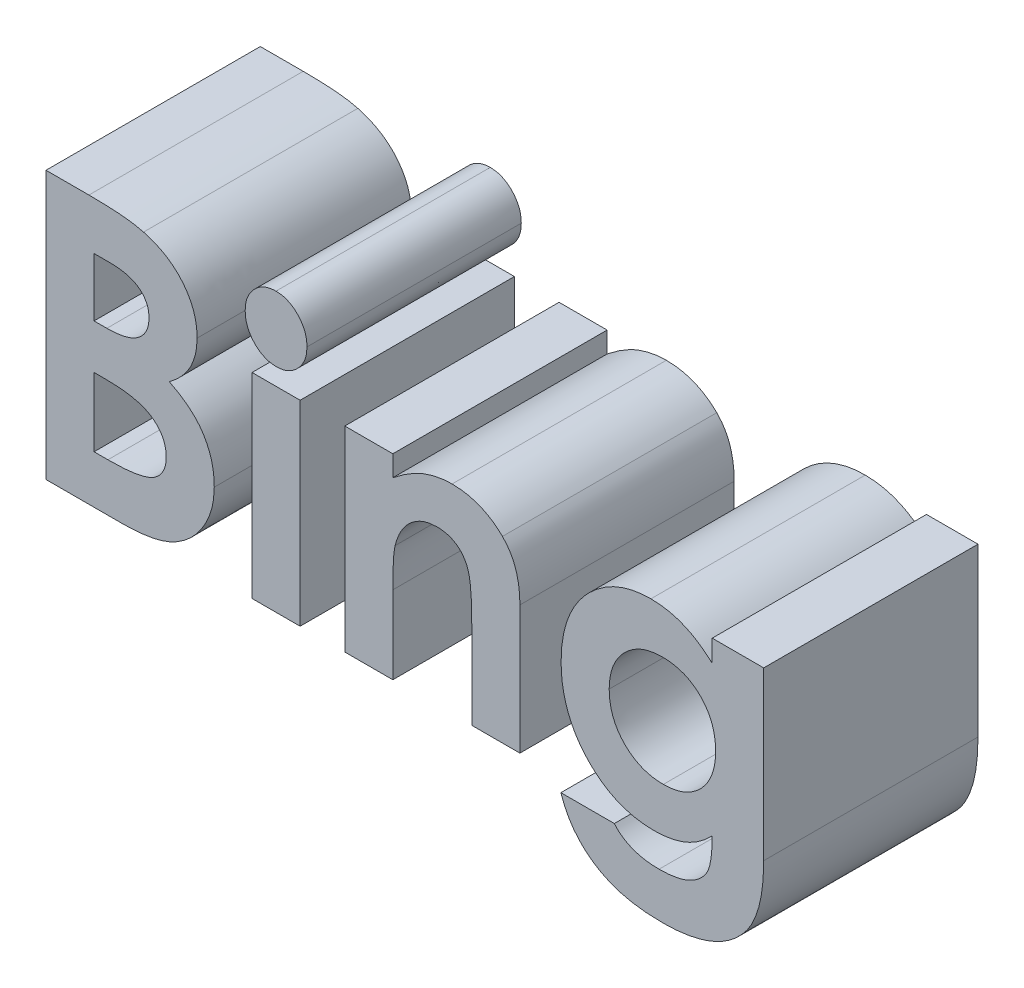
from build123d import *

# Parameters (mm, degrees)
BOSS_EXTRUDE1_DEPTH   = 2.54
BOSS_EXTRUDE1_2_DEPTH = 2.54
SKETCH1_W             = 0.569871795
SKETCH1_H             = 2.320192308
BOSS_EXTRUDE1_3_DEPTH = 2.54
BOSS_EXTRUDE1_4_DEPTH = 2.54
BOSS_EXTRUDE1_5_DEPTH = 2.54


with BuildPart() as part:
    # Sketch1 → Boss-Extrude1 (new body)
    with BuildSketch(Plane.XY):
        with BuildLine():
            Line((0.366346154, 0), (0.366346154, 3.175))
            Line((0.366346154, 3.175), (0.875160256, 3.175))
            add(Edge.make_bspline(
                [(0.875160256, 3.175), (0.910780425, 3.175004065), (0.979704776, 3.175011931), (1.079144627, 3.17151993), (1.171366691, 3.167002635), (1.256077481, 3.161948833), (1.333421182, 3.153240122), (1.403280178, 3.144062092), (1.46579405, 3.132993954), (1.504442981, 3.12306549), (1.522626202, 3.118394431)],
                knots=[0, 0, 0, 0, 1.311965854, 2.538629056, 3.664479157, 4.713267157, 5.663616078, 6.530575999, 7.308677837, 8, 8, 8, 8], degree=3))
            add(Edge.make_bspline(
                [(1.522626202, 3.118394431), (1.546502618, 3.111805819), (1.593355811, 3.098876846), (1.660464535, 3.072766227), (1.724126521, 3.043742423), (1.784264039, 3.010631691), (1.840507821, 2.973034291), (1.892644122, 2.93065184), (1.941797392, 2.885185567), (1.986222312, 2.83536834), (2.026375119, 2.782727211), (2.06126071, 2.727275975), (2.091571817, 2.669862516), (2.115828642, 2.609764324), (2.134105704, 2.547258168), (2.14747347, 2.482610959), (2.156137594, 2.415618137), (2.15695624, 2.37004073), (2.157371795, 2.346905048)],
                knots=[0, 0, 0, 0, 1.099996261, 2.158545794, 3.195537121, 4.207578794, 5.205712374, 6.197378256, 7.190519799, 8.17788031, 9.159561366, 10.129234751, 11.085776129, 12.040971148, 13.00380137, 13.975669004, 14.972423361, 16, 16, 16, 16], degree=3))
            add(Edge.make_bspline(
                [(2.157371795, 2.346905048), (2.156285241, 2.317181769), (2.154146494, 2.258675147), (2.14048403, 2.172739505), (2.11486478, 2.091517971), (2.081342616, 2.013513663), (2.035762953, 1.939017538), (1.977885596, 1.868065017), (1.908647969, 1.798471365), (1.855538887, 1.756754665), (1.827914663, 1.73505609)],
                knots=[0, 0, 0, 0, 0.986156485, 1.941127874, 2.875419072, 3.804401753, 4.751181392, 5.761612777, 6.835722519, 8, 8, 8, 8], degree=3))
            add(Edge.make_bspline(
                [(1.827914663, 1.73505609), (1.850300009, 1.723628565), (1.894191478, 1.701222351), (1.956504469, 1.664393223), (2.014199497, 1.625220775), (2.067535248, 1.584493172), (2.115392945, 1.540483912), (2.159748712, 1.495728868), (2.198414265, 1.447663764), (2.232990168, 1.39800173), (2.263042981, 1.346023655), (2.289215667, 1.291817318), (2.311322796, 1.235197538), (2.330043685, 1.176452465), (2.344005729, 1.115380042), (2.353109278, 1.051958428), (2.360079525, 0.986403923), (2.360621744, 0.94174983), (2.360897436, 0.919045473)],
                knots=[0, 0, 0, 0, 1.164658916, 2.283573913, 3.35186032, 4.395461096, 5.390182219, 6.362969632, 7.312859996, 8.245001507, 9.165155236, 10.092416118, 11.032087915, 11.979892451, 12.947605196, 13.931445124, 14.948243989, 16, 16, 16, 16], degree=3))
            add(Edge.make_bspline(
                [(2.360897436, 0.919045473), (2.359108383, 0.875681448), (2.355577694, 0.790102718), (2.32976302, 0.664453489), (2.285008578, 0.545326623), (2.224912592, 0.433195582), (2.150862773, 0.331306375), (2.065726717, 0.242052315), (1.970361548, 0.166500734), (1.882375654, 0.115509278), (1.806274784, 0.081289243), (1.743241855, 0.060132259), (1.675545826, 0.040532461), (1.601946667, 0.026769079), (1.523778631, 0.014171317), (1.440279575, 0.006393198), (1.351605558, 0.001122159), (1.290700409, 0.000381615), (1.259314904, 0)],
                knots=[0, 0, 0, 0, 1.284142165, 2.534249414, 3.780121997, 5.041676246, 6.291546858, 7.49970053, 8.684500223, 9.883330709, 10.50184324, 11.153274765, 11.851151195, 12.587658647, 13.369265475, 14.195992086, 15.070362669, 16, 16, 16, 16], degree=3))
            Line((1.259314904, 0), (0.366346154, 0))
        make_face()
        with BuildLine():
            Line((0.936217949, 2.605128205), (0.936217949, 1.913141026))
            Line((0.936217949, 1.913141026), (1.087590144, 1.913141026))
            add(Edge.make_bspline(
                [(1.087590144, 1.913141026), (1.108162986, 1.913320429), (1.147877611, 1.913666755), (1.205241174, 1.918127321), (1.258580025, 1.925737323), (1.307691859, 1.936355191), (1.353034171, 1.949838335), (1.394317303, 1.966061461), (1.431359738, 1.985855437), (1.474394481, 2.015339439), (1.519885308, 2.058726468), (1.559930371, 2.12140802), (1.583516645, 2.193491567), (1.58614352, 2.244330466), (1.5875, 2.270582933)],
                knots=[0, 0, 0, 0, 1.065314748, 2.056525647, 2.977365736, 3.853934255, 4.656397591, 5.425096493, 6.14721249, 6.826394842, 8.123232004, 9.372140726, 10.643011755, 12, 12, 12, 12], degree=3))
            add(Edge.make_bspline(
                [(1.5875, 2.270582933), (1.586414568, 2.29517273), (1.584315928, 2.342716114), (1.560567582, 2.409471259), (1.523681706, 2.46862998), (1.480132744, 2.509119286), (1.439122935, 2.536772289), (1.404007819, 2.554980614), (1.365466343, 2.57128052), (1.322752384, 2.583743825), (1.276109864, 2.593095851), (1.22576535, 2.599963794), (1.171631981, 2.604638408), (1.134241948, 2.604961437), (1.114938902, 2.605128205)],
                knots=[0, 0, 0, 0, 1.347982417, 2.606269829, 3.849316587, 5.153353503, 5.842674298, 6.568177932, 7.326619318, 8.142485038, 9.012069166, 9.942760135, 10.937925643, 12, 12, 12, 12], degree=3))
            Line((1.114938902, 2.605128205), (0.936217949, 2.605128205))
        make_face(mode=Mode.SUBTRACT)
        with BuildLine():
            Line((0.936217949, 1.383974359), (0.936217949, 0.569871795))
            Line((0.936217949, 0.569871795), (1.100310497, 0.569871795))
            add(Edge.make_bspline(
                [(1.100310497, 0.569871795), (1.132751802, 0.570057131), (1.195124261, 0.570413462), (1.284472697, 0.574718795), (1.365712762, 0.582478398), (1.438629202, 0.592165637), (1.5033337, 0.605290331), (1.559607542, 0.621976697), (1.608222448, 0.640334606), (1.648886923, 0.663008804), (1.682107469, 0.689395947), (1.712085529, 0.716364242), (1.736527771, 0.747474717), (1.755866929, 0.781391887), (1.772604936, 0.817273225), (1.78270012, 0.856519883), (1.790386238, 0.897968686), (1.790809226, 0.926637926), (1.791025641, 0.94130609)],
                knots=[0, 0, 0, 0, 1.753078804, 3.370512758, 4.83203934, 6.162291463, 7.344201807, 8.395507345, 9.331626367, 10.147333109, 10.898971645, 11.62040215, 12.321813352, 13.025280112, 13.727906689, 14.453419512, 15.208716525, 16, 16, 16, 16], degree=3))
            add(Edge.make_bspline(
                [(1.791025641, 0.94130609), (1.790548384, 0.958079366), (1.789618815, 0.990749196), (1.782027018, 1.038499638), (1.768230243, 1.083077845), (1.750852532, 1.12562374), (1.726670524, 1.164614032), (1.697931033, 1.201398029), (1.663206391, 1.234730109), (1.624156506, 1.266626322), (1.578608681, 1.294553184), (1.526541547, 1.318784684), (1.467672246, 1.339021941), (1.401818424, 1.355134857), (1.329268781, 1.368809667), (1.249493782, 1.376975038), (1.163157822, 1.383047983), (1.103291063, 1.383658551), (1.072325721, 1.383974359)],
                knots=[0, 0, 0, 0, 0.845221588, 1.646264278, 2.427170338, 3.19324141, 3.95557735, 4.731569926, 5.540061037, 6.376114724, 7.268642756, 8.224665384, 9.265483498, 10.400594375, 11.639216012, 12.983232105, 14.439614077, 16, 16, 16, 16], degree=3))
            Line((1.072325721, 1.383974359), (0.936217949, 1.383974359))
        make_face(mode=Mode.SUBTRACT)
    extrude(amount=BOSS_EXTRUDE1_DEPTH)


with BuildPart() as body_2:
    # Sketch1 → Boss-Extrude1 2 (new body)
    with BuildSketch(Plane.XY):
        with BuildLine():
            add(Edge.make_bspline(
                [(3.092317708, 3.297115385), (3.116879179, 3.295910306), (3.165107992, 3.293544018), (3.23420233, 3.270477972), (3.29761693, 3.234276503), (3.353677194, 3.184607225), (3.40030288, 3.125293022), (3.435926636, 3.058886828), (3.455771146, 2.985310904), (3.458527255, 2.934485425), (3.459935897, 2.908508614)],
                knots=[0, 0, 0, 0, 0.989868614, 1.943702388, 2.910836514, 3.924849579, 4.949916355, 5.946401046, 6.950409252, 8, 8, 8, 8], degree=3))
            add(Edge.make_bspline(
                [(3.459935897, 2.908508614), (3.458577654, 2.882723237), (3.455931052, 2.832479203), (3.435469902, 2.759902107), (3.40127596, 2.693528166), (3.354272636, 2.635094889), (3.298820138, 2.586225564), (3.236791196, 2.549366879), (3.168358982, 2.527583993), (3.120878534, 2.525019896), (3.096769832, 2.523717949)],
                knots=[0, 0, 0, 0, 1.05296456, 2.051751585, 3.055639087, 4.085634717, 5.099016424, 6.062201612, 7.016062274, 8, 8, 8, 8], degree=3))
            add(Edge.make_bspline(
                [(3.096769832, 2.523717949), (3.07199396, 2.524918719), (3.023345558, 2.52727648), (2.953684504, 2.550396495), (2.889424116, 2.586312854), (2.83360704, 2.636996953), (2.786447386, 2.696732628), (2.75237969, 2.764684816), (2.731069504, 2.83876385), (2.728540003, 2.890342089), (2.72724359, 2.916776843)],
                knots=[0, 0, 0, 0, 0.989065327, 1.942068821, 2.907541208, 3.917690034, 4.939857478, 5.938239964, 6.943311734, 8, 8, 8, 8], degree=3))
            add(Edge.make_bspline(
                [(2.72724359, 2.916776843), (2.728654442, 2.942124368), (2.731425858, 2.991915923), (2.751389239, 3.063856038), (2.786196143, 3.12914584), (2.832485979, 3.187374241), (2.888053846, 3.236117001), (2.951430377, 3.271219008), (3.020059708, 3.29333236), (3.067983009, 3.295841356), (3.092317708, 3.297115385)],
                knots=[0, 0, 0, 0, 1.038616768, 2.040212704, 3.031499824, 4.052181184, 5.074969369, 6.039807101, 7.004644834, 8, 8, 8, 8], degree=3))
        make_face()
    extrude(amount=BOSS_EXTRUDE1_2_DEPTH)


with BuildPart() as body_3:
    # Sketch1 → Boss-Extrude1 3 (new body)
    with BuildSketch(Plane.XY):
        with Locations((3.093589744, 1.160096154)):
            Rectangle(SKETCH1_W, SKETCH1_H)
    extrude(amount=BOSS_EXTRUDE1_3_DEPTH)


with BuildPart() as body_4:
    # Sketch1 → Boss-Extrude1 4 (new body)
    with BuildSketch(Plane.XY):
        with BuildLine():
            Line((3.907692308, 2.320192308), (4.477564103, 2.320192308))
            Line((4.477564103, 2.320192308), (4.477564103, 2.074689503))
            add(Edge.make_bspline(
                [(4.477564103, 2.074689503), (4.510075006, 2.099977153), (4.572209662, 2.148306769), (4.666665068, 2.209927275), (4.755819276, 2.260361185), (4.84165963, 2.298723797), (4.925801219, 2.326324047), (5.009606774, 2.346153181), (5.094324332, 2.35885032), (5.151275095, 2.36021543), (5.179727564, 2.360897436)],
                knots=[0, 0, 0, 0, 1.276643801, 2.439914479, 3.493451431, 4.44993799, 5.350072675, 6.235028322, 7.118224225, 8, 8, 8, 8], degree=3))
            add(Edge.make_bspline(
                [(5.179727564, 2.360897436), (5.208588766, 2.360118044), (5.265245728, 2.358588033), (5.348669983, 2.347886845), (5.428373757, 2.328396591), (5.505253254, 2.302518806), (5.57852597, 2.268361613), (5.649089543, 2.227805489), (5.715428291, 2.178405385), (5.756282628, 2.140784638), (5.776948117, 2.121754808)],
                knots=[0, 0, 0, 0, 1.048836932, 2.058954983, 3.049370783, 4.026390553, 5.001981509, 5.982488534, 6.97947532, 8, 8, 8, 8], degree=3))
            add(Edge.make_bspline(
                [(5.776948117, 2.121754808), (5.7935226, 2.10411972), (5.82679287, 2.068720476), (5.868659325, 2.008143303), (5.904585453, 1.942103097), (5.934021923, 1.869838062), (5.955774288, 1.790951149), (5.972508679, 1.706395199), (5.981898638, 1.615696762), (5.983057873, 1.553387791), (5.983653846, 1.521354167)],
                knots=[0, 0, 0, 0, 0.889584746, 1.785680191, 2.700364693, 3.65222533, 4.649950538, 5.707241244, 6.821271309, 8, 8, 8, 8], degree=3))
            Line((5.983653846, 1.521354167), (5.983653846, 0))
            Line((5.983653846, 0), (5.413782051, 0))
            Line((5.413782051, 0), (5.413782051, 1.007451923))
            add(Edge.make_bspline(
                [(5.413782051, 1.007451923), (5.413661536, 1.04031325), (5.413430591, 1.103285883), (5.411657443, 1.193409185), (5.408195224, 1.27480223), (5.405039503, 1.347613213), (5.398843567, 1.411583603), (5.393255971, 1.467118384), (5.384682348, 1.513713739), (5.373526673, 1.563834035), (5.354046117, 1.617496978), (5.323803504, 1.674039753), (5.285436508, 1.722074101), (5.240512191, 1.761936766), (5.189080167, 1.793471791), (5.131761919, 1.815658645), (5.068864741, 1.829486038), (5.025038726, 1.830963488), (5.002278646, 1.831730769)],
                knots=[0, 0, 0, 0, 1.49886392, 2.872294502, 4.110984203, 5.214877267, 6.195405875, 7.042225351, 7.75923308, 8.355011229, 9.382752534, 10.352059385, 11.267231453, 12.171456522, 13.078624015, 14.003401117, 14.963110155, 16, 16, 16, 16], degree=3))
            add(Edge.make_bspline(
                [(5.002278646, 1.831730769), (4.972678205, 1.830229723), (4.914773988, 1.827293385), (4.831027121, 1.805150715), (4.75410702, 1.767492551), (4.684642184, 1.715381225), (4.623294208, 1.651043335), (4.572766388, 1.574313021), (4.531323195, 1.487042165), (4.513502006, 1.423320264), (4.504276843, 1.390334535)],
                knots=[0, 0, 0, 0, 0.984188326, 1.925263693, 2.85911992, 3.81709677, 4.80007086, 5.801799564, 6.862098548, 8, 8, 8, 8], degree=3))
            add(Edge.make_bspline(
                [(4.504276843, 1.390334535), (4.501984024, 1.379975146), (4.496870575, 1.356871626), (4.492665411, 1.317840753), (4.486815722, 1.271534401), (4.484623987, 1.217114556), (4.480812802, 1.154838765), (4.479403243, 1.084624637), (4.477991163, 1.00660985), (4.477711172, 0.952119486), (4.477564103, 0.923497596)],
                knots=[0, 0, 0, 0, 0.543362196, 1.211806945, 2.009705693, 2.934833164, 4.000995085, 5.207458376, 6.533175157, 8, 8, 8, 8], degree=3))
            Line((4.477564103, 0.923497596), (4.477564103, 0))
            Line((4.477564103, 0), (3.907692308, 0))
            Line((3.907692308, 0), (3.907692308, 2.320192308))
        make_face()
    extrude(amount=BOSS_EXTRUDE1_4_DEPTH)


with BuildPart() as body_5:
    # Sketch1 → Boss-Extrude1 5 (new body)
    with BuildSketch(Plane.XY):
        with BuildLine():
            Line((8.263141026, 2.320192308), (8.873717949, 2.320192308))
            Line((8.873717949, 2.320192308), (8.873717949, 0.340905449))
            add(Edge.make_bspline(
                [(8.873717949, 0.340905449), (8.872984194, 0.293606796), (8.871567286, 0.202271242), (8.860758703, 0.069902431), (8.842733997, -0.052810738), (8.816797082, -0.166042054), (8.783298309, -0.26937534), (8.74232804, -0.363154127), (8.694719283, -0.447881326), (8.655574288, -0.497389462), (8.636483373, -0.521534455)],
                knots=[0, 0, 0, 0, 1.243822755, 2.401870584, 3.490053692, 4.503076575, 5.453444971, 6.342269266, 7.191528908, 8, 8, 8, 8], degree=3))
            add(Edge.make_bspline(
                [(8.636483373, -0.521534455), (8.609068556, -0.551605384), (8.554377715, -0.611594999), (8.457954698, -0.687299771), (8.352319731, -0.752003279), (8.236394791, -0.805030905), (8.110317957, -0.84542104), (7.974413109, -0.874509135), (7.828594087, -0.892626571), (7.72788079, -0.894532727), (7.676096755, -0.895512821)],
                knots=[0, 0, 0, 0, 0.916003385, 1.827369254, 2.751972866, 3.703651841, 4.69362366, 5.730423306, 6.83304546, 8, 8, 8, 8], degree=3))
            add(Edge.make_bspline(
                [(7.676096755, -0.895512821), (7.621358034, -0.894665399), (7.516081378, -0.89303559), (7.364800994, -0.877092316), (7.226999142, -0.85085876), (7.102028706, -0.81392563), (6.988725402, -0.766271212), (6.884952616, -0.709130814), (6.790909641, -0.640814766), (6.705174973, -0.56401633), (6.629736961, -0.477048972), (6.5653203, -0.38070894), (6.510440654, -0.275882367), (6.483343204, -0.200919378), (6.469571314, -0.162820513)],
                knots=[0, 0, 0, 0, 1.29412125, 2.488928388, 3.592140377, 4.607309753, 5.564519828, 6.493640275, 7.402258018, 8.307438948, 9.210158992, 10.116782752, 11.042881838, 12, 12, 12, 12], degree=3))
            Line((6.469571314, -0.162820513), (7.103044872, -0.162820513))
            add(Edge.make_bspline(
                [(7.103044872, -0.162820513), (7.117683769, -0.178936543), (7.147147594, -0.211373406), (7.199261072, -0.252533588), (7.25691039, -0.287764698), (7.320560662, -0.316613299), (7.39047728, -0.338550073), (7.466184311, -0.35521613), (7.548020863, -0.364608326), (7.604415358, -0.365755071), (7.633483574, -0.366346154)],
                knots=[0, 0, 0, 0, 0.888971165, 1.789239437, 2.70354581, 3.646217955, 4.638595249, 5.694475788, 6.811630907, 8, 8, 8, 8], degree=3))
            add(Edge.make_bspline(
                [(7.633483574, -0.366346154), (7.670218155, -0.365659789), (7.740377985, -0.364348893), (7.839638668, -0.350015665), (7.928280405, -0.32860266), (8.005023607, -0.296376611), (8.071233706, -0.257668692), (8.126469051, -0.212704411), (8.172077382, -0.163177808), (8.201910002, -0.116585374), (8.219637655, -0.074318483), (8.23170913, -0.03782163), (8.240876337, 0.004247617), (8.249220915, 0.051101874), (8.255458622, 0.10334478), (8.259591183, 0.160865658), (8.263174733, 0.223411084), (8.26315251, 0.266909506), (8.263141026, 0.289388021)],
                knots=[0, 0, 0, 0, 1.656375485, 3.163532, 4.516250129, 5.759907703, 6.905105653, 7.965920022, 8.961443813, 9.932912751, 10.442911961, 11.026787936, 11.664959534, 12.383728702, 13.174001396, 14.037595414, 14.985895623, 16, 16, 16, 16], degree=3))
            add(Edge.make_bspline(
                [(8.263141026, 0.289388021), (8.238175116, 0.264901812), (8.189456806, 0.217119587), (8.110370241, 0.156159756), (8.029411138, 0.105808436), (7.946114237, 0.065781342), (7.858822951, 0.036462202), (7.767024588, 0.015405031), (7.669673678, 0.002574562), (7.602781954, 0.000870522), (7.568609776, 0)],
                knots=[0, 0, 0, 0, 1.082007397, 2.111422008, 3.08419067, 4.02964304, 4.965866572, 5.929243163, 6.942137121, 8, 8, 8, 8], degree=3))
            add(Edge.make_bspline(
                [(7.568609776, 0), (7.530811369, 0.000873215), (7.456561895, 0.002588518), (7.347504698, 0.019257916), (7.242874015, 0.045193872), (7.142388107, 0.081299149), (7.047072323, 0.129234185), (6.955570283, 0.186263507), (6.869577787, 0.25538168), (6.787908467, 0.332730301), (6.714093857, 0.418706678), (6.649141565, 0.511045191), (6.594385154, 0.60910889), (6.54985562, 0.712806616), (6.514376965, 0.821703048), (6.489960097, 0.936387726), (6.475039494, 1.056667012), (6.473103046, 1.138639587), (6.472115385, 1.180448718)],
                knots=[0, 0, 0, 0, 1.007560175, 1.979205489, 2.935124557, 3.879618859, 4.820364716, 5.775815361, 6.749909327, 7.75781854, 8.772289371, 9.766897274, 10.764314289, 11.762244114, 12.772609037, 13.814079916, 14.885097635, 16, 16, 16, 16], degree=3))
            add(Edge.make_bspline(
                [(6.472115385, 1.180448718), (6.472978009, 1.225022915), (6.474663902, 1.312137627), (6.491190458, 1.439379788), (6.516906579, 1.560224706), (6.553617017, 1.674419597), (6.601846294, 1.781476285), (6.660129447, 1.88173447), (6.727916674, 1.976340644), (6.781575927, 2.032464525), (6.80856871, 2.060697115)],
                knots=[0, 0, 0, 0, 1.104124469, 2.157873671, 3.173961494, 4.162551312, 5.124378318, 6.07778831, 7.033049473, 8, 8, 8, 8], degree=3))
            add(Edge.make_bspline(
                [(6.80856871, 2.060697115), (6.834184472, 2.084770385), (6.884661609, 2.132207965), (6.967292527, 2.193078254), (7.052871004, 2.245286777), (7.142570845, 2.287282647), (7.235757332, 2.320725859), (7.332982139, 2.34412204), (7.433761838, 2.358547586), (7.502203512, 2.360108306), (7.536808894, 2.360897436)],
                knots=[0, 0, 0, 0, 1.042068658, 2.053448347, 3.038272799, 4.011764631, 4.986555969, 5.970496305, 6.973845226, 8, 8, 8, 8], degree=3))
            add(Edge.make_bspline(
                [(7.536808894, 2.360897436), (7.569282129, 2.359985599), (7.6336299, 2.358178736), (7.72896534, 2.345430553), (7.821281104, 2.322909039), (7.911587987, 2.291946691), (8.000843167, 2.251838496), (8.088969514, 2.19926898), (8.177753762, 2.136410695), (8.23409047, 2.087295741), (8.263141026, 2.061969151)],
                knots=[0, 0, 0, 0, 0.968122651, 1.918396369, 2.861262201, 3.796768263, 4.761417965, 5.77287463, 6.85156174, 8, 8, 8, 8], degree=3))
            Line((8.263141026, 2.061969151), (8.263141026, 2.320192308))
        make_face()
        with BuildLine():
            add(Edge.make_bspline(
                [(7.672916667, 1.831730769), (7.650637359, 1.831012854), (7.606775144, 1.829599465), (7.542311535, 1.821636291), (7.481135272, 1.806605034), (7.42250076, 1.787087474), (7.367120894, 1.760832489), (7.314888615, 1.728799305), (7.265184805, 1.691617617), (7.219591067, 1.648585796), (7.177328798, 1.602088929), (7.141843922, 1.550916476), (7.110220572, 1.49798228), (7.085628726, 1.441156295), (7.065293427, 1.381980658), (7.052865331, 1.319251174), (7.042934899, 1.254114419), (7.042307189, 1.209535448), (7.041987179, 1.186808894)],
                knots=[0, 0, 0, 0, 1.059154978, 2.085203149, 3.079850876, 4.048488546, 5.017545358, 5.985239295, 6.956545898, 7.961752598, 8.960830395, 9.936516972, 10.916356752, 11.886198968, 12.873933111, 13.883774911, 14.921139228, 16, 16, 16, 16], degree=3))
            add(Edge.make_bspline(
                [(7.041987179, 1.186808894), (7.042333577, 1.163241141), (7.043013424, 1.116986521), (7.052531908, 1.04960218), (7.066128921, 0.985111311), (7.08666833, 0.924301142), (7.112381774, 0.866372659), (7.143269589, 0.811354331), (7.18139887, 0.760561619), (7.223740135, 0.712876724), (7.270581016, 0.669764123), (7.321001079, 0.632265425), (7.37396227, 0.599881439), (7.430609435, 0.574632214), (7.489716906, 0.554171586), (7.551877519, 0.53931308), (7.616948427, 0.531285114), (7.661236141, 0.529880196), (7.683728966, 0.529166667)],
                knots=[0, 0, 0, 0, 1.097915424, 2.154794285, 3.166904039, 4.167166757, 5.140698173, 6.119085138, 7.101657521, 8.095747232, 9.089148684, 10.06378348, 11.021581144, 11.977080764, 12.949256321, 13.934658686, 14.951055324, 16, 16, 16, 16], degree=3))
            add(Edge.make_bspline(
                [(7.683728966, 0.529166667), (7.705814218, 0.529512946), (7.749116415, 0.53019189), (7.812282077, 0.539716145), (7.872631669, 0.553487411), (7.930056503, 0.573180356), (7.984237884, 0.598883924), (8.035902864, 0.629557234), (8.083955527, 0.66667543), (8.1293072, 0.708640103), (8.170234191, 0.755303709), (8.206359023, 0.805863114), (8.236034263, 0.860327448), (8.261311498, 0.917834424), (8.280026815, 0.979195245), (8.294236981, 1.043800588), (8.302572582, 1.11196343), (8.30341615, 1.158589443), (8.303846154, 1.182356771)],
                knots=[0, 0, 0, 0, 1.047368431, 2.053558439, 3.025081491, 3.983010266, 4.928381778, 5.867249904, 6.829345556, 7.804873619, 8.796055618, 9.770545002, 10.747991713, 11.735078325, 12.747239243, 13.787476531, 14.872179528, 16, 16, 16, 16], degree=3))
            add(Edge.make_bspline(
                [(8.303846154, 1.182356771), (8.303428971, 1.205914162), (8.302614402, 1.25191115), (8.29416109, 1.319207913), (8.280074419, 1.383002876), (8.261099864, 1.443822541), (8.236371773, 1.501303706), (8.205362855, 1.55491138), (8.16990284, 1.605635452), (8.128149903, 1.651748124), (8.083146424, 1.694398026), (8.033531211, 1.730478933), (7.981785543, 1.76235872), (7.926162288, 1.787631888), (7.867352347, 1.807537684), (7.805261263, 1.821154382), (7.740205701, 1.830709417), (7.695637652, 1.831385897), (7.672916667, 1.831730769)],
                knots=[0, 0, 0, 0, 1.111098411, 2.169475416, 3.193737863, 4.190319778, 5.171520483, 6.139320596, 7.107999188, 8.085777416, 9.069626166, 10.027970922, 10.974971434, 11.932846196, 12.904000912, 13.89897495, 14.928888274, 16, 16, 16, 16], degree=3))
        make_face(mode=Mode.SUBTRACT)
    extrude(amount=BOSS_EXTRUDE1_5_DEPTH)


solid = Compound([part.part, body_2.part, body_3.part, body_4.part, body_5.part])
